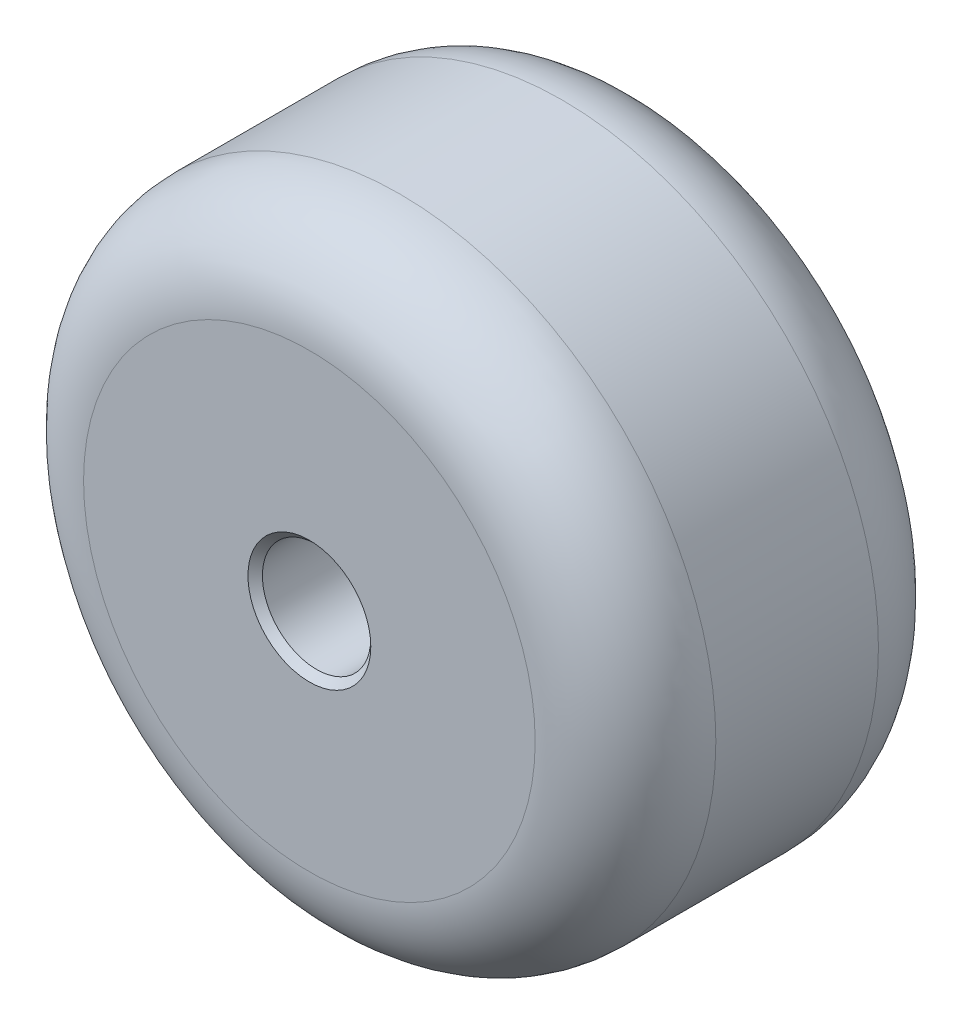
from build123d import *

# Parameters (mm, degrees)
SKETCH_1_R      = 17.5
SKETCH_1_R_2    = 3
EXTRUDE_1_DEPTH = 9.5
FILLET_1_R      = 5
CHAMFER_1_SIZE  = 0.4


with BuildPart() as part:
    # 草图1 → 凸台-拉伸1 (new, symmetric)
    with BuildSketch(Plane.XY):
        Circle(SKETCH_1_R)
        Circle(SKETCH_1_R_2, mode=Mode.SUBTRACT)
    extrude(amount=EXTRUDE_1_DEPTH, both=True)

    # 圆角1
    fillet_1_edges = [part.edges().sort_by_distance(p)[0] for p in [
        (-17.5, 0, -9.5),
        (-17.5, 0, 9.5),
    ]]
    fillet(fillet_1_edges, radius=FILLET_1_R)

    # 倒角1
    chamfer_1_edges = [part.edges().sort_by_distance(p)[0] for p in [
        (-3, 0, -9.5),
        (-3, 0, 9.5),
    ]]
    chamfer(chamfer_1_edges, length=CHAMFER_1_SIZE)


solid = part.part
